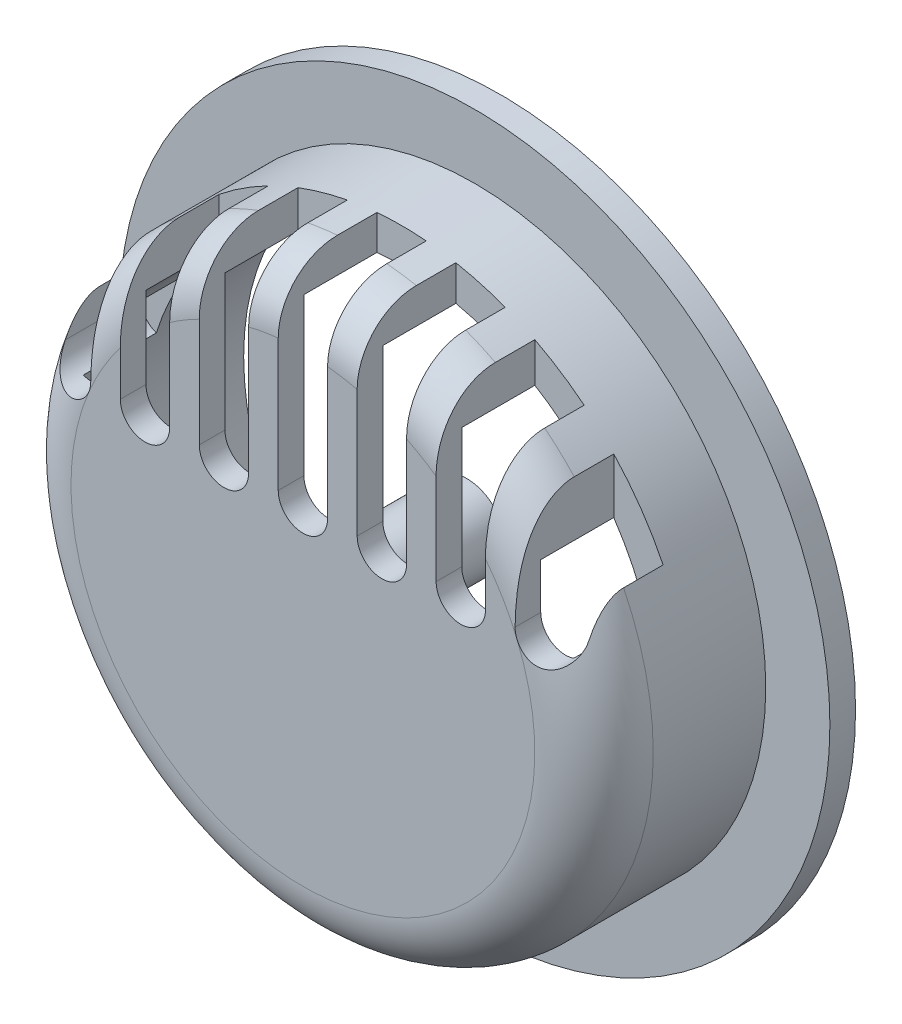
from build123d import *

# Parameters (mm, degrees)
SKETCH1_R           = 18
BOSS_EXTRUDE1_DEPTH = 1.3
SKETCH2_R           = 14.75
BOSS_EXTRUDE2_DEPTH = 8.7
FILLET1_R           = 3
SKETCH3_R           = 13
CUT_EXTRUDE1_DEPTH  = 8.7
SKETCH4_R           = 2
BOSS_EXTRUDE3_DEPTH = 7
SKETCH5_R           = 1.15
CUT_EXTRUDE2_DEPTH  = 6
CUT_EXTRUDE3_DEPTH  = 5


with BuildPart() as part:
    # Sketch1 → Boss-Extrude1 (new body)
    with BuildSketch(Plane.XY):
        Circle(SKETCH1_R)
    extrude(amount=BOSS_EXTRUDE1_DEPTH)

    # Sketch2 → Boss-Extrude2 (add)
    with BuildSketch(Plane.XY.offset(1.3)):
        Circle(SKETCH2_R)
    extrude(amount=BOSS_EXTRUDE2_DEPTH)

    # Fillet1
    fillet1_edges = [part.edges().sort_by_distance(p)[0] for p in [
        (-14.75, 0, 10),
    ]]
    fillet(fillet1_edges, radius=FILLET1_R)

    # Sketch3 → Cut-Extrude1 (cut)
    with BuildSketch(Plane(origin=(0, 0, 0), x_dir=(-1, 0, 0), z_dir=(0, 0, -1))):
        Circle(SKETCH3_R)
    extrude(amount=-CUT_EXTRUDE1_DEPTH, mode=Mode.SUBTRACT)

    # Sketch4 → Boss-Extrude3 (add)
    with BuildSketch(Plane(origin=(0, 0, 8.7), x_dir=(-1, 0, 0), z_dir=(0, 0, -1))):
        Circle(SKETCH4_R)
    extrude(amount=BOSS_EXTRUDE3_DEPTH)

    # Sketch5 → Cut-Extrude2 (cut)
    with BuildSketch(Plane(origin=(0, 0, 1.7), x_dir=(-1, 0, 0), z_dir=(0, 0, -1))):
        Circle(SKETCH5_R)
    extrude(amount=-CUT_EXTRUDE2_DEPTH, mode=Mode.SUBTRACT)

    # Sketch8 → Cut-Extrude3 (cut)
    with BuildSketch(Plane.XY.offset(10)):
        with BuildLine():
            Line((-1.25, 5), (-1.25, 20))
            ThreePointArc((-1.25, 20), (0, 21.25), (1.25, 20))
            Line((1.25, 20), (1.25, 5))
            ThreePointArc((1.25, 5), (0, 3.75), (-1.25, 5))
        make_face()
        with BuildLine():
            Line((2.75, 5), (2.75, 20))
            ThreePointArc((2.75, 20), (4, 21.25), (5.25, 20))
            Line((5.25, 20), (5.25, 5))
            ThreePointArc((5.25, 5), (4, 3.75), (2.75, 5))
        make_face()
        with BuildLine():
            Line((6.75, 5), (6.75, 20))
            ThreePointArc((6.75, 20), (8, 21.25), (9.25, 20))
            Line((9.25, 20), (9.25, 5))
            ThreePointArc((9.25, 5), (8, 3.75), (6.75, 5))
        make_face()
        with BuildLine():
            Line((10.75, 5), (10.75, 20))
            ThreePointArc((10.75, 20), (12, 21.25), (13.25, 20))
            Line((13.25, 20), (13.25, 5))
            ThreePointArc((13.25, 5), (12, 3.75), (10.75, 5))
        make_face()
        with BuildLine():
            Line((-5.25, 5), (-5.25, 20))
            ThreePointArc((-5.25, 20), (-4, 21.25), (-2.75, 20))
            Line((-2.75, 20), (-2.75, 5))
            ThreePointArc((-2.75, 5), (-4, 3.75), (-5.25, 5))
        make_face()
        with BuildLine():
            Line((-9.25, 5), (-9.25, 20))
            ThreePointArc((-9.25, 20), (-8, 21.25), (-6.75, 20))
            Line((-6.75, 20), (-6.75, 5))
            ThreePointArc((-6.75, 5), (-8, 3.75), (-9.25, 5))
        make_face()
        with BuildLine():
            Line((-13.25, 5), (-13.25, 20))
            ThreePointArc((-13.25, 20), (-12, 21.25), (-10.75, 20))
            Line((-10.75, 20), (-10.75, 5))
            ThreePointArc((-10.75, 5), (-12, 3.75), (-13.25, 5))
        make_face()
    extrude(amount=-CUT_EXTRUDE3_DEPTH, mode=Mode.SUBTRACT)


solid = part.part
